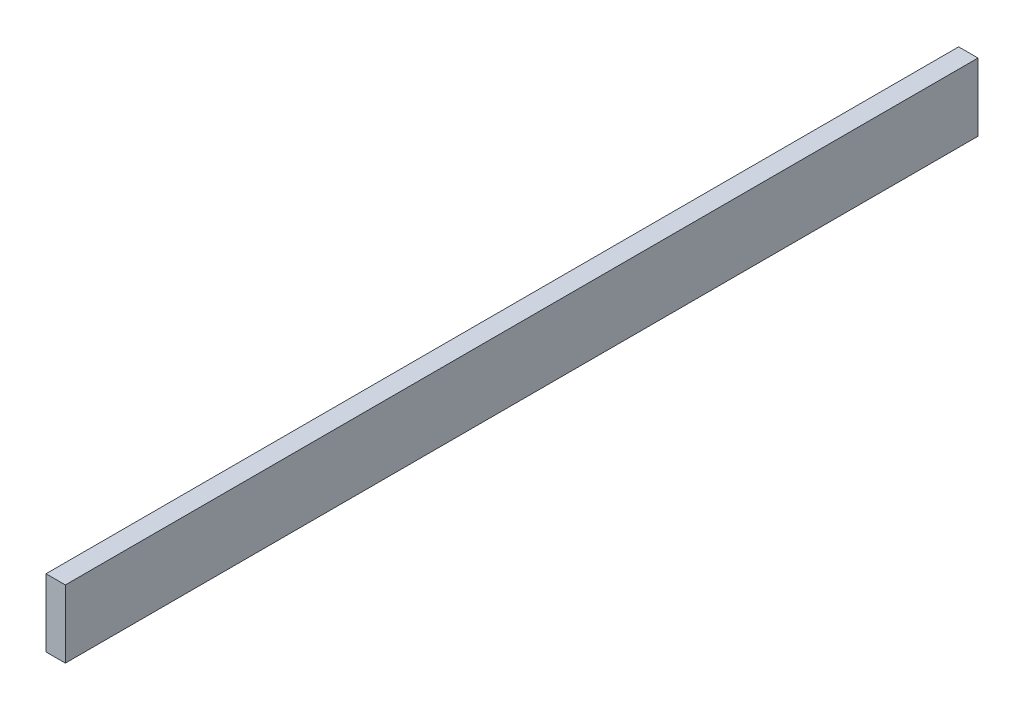
from build123d import *

# Parameters (mm, degrees)
SKETCH1_W                       = 14
SKETCH1_H                       = 49
DET2_RAY_DIS_PROFIL_SAG_1_DEPTH = 660


with BuildPart() as part:
    # Sketch1 → DET2_ray_dis_profil_sag_1 (new body)
    with BuildSketch(Plane.XY):
        with Locations((1331, 1552.5)):
            Rectangle(SKETCH1_W, SKETCH1_H)
    extrude(amount=-DET2_RAY_DIS_PROFIL_SAG_1_DEPTH)


solid = part.part
